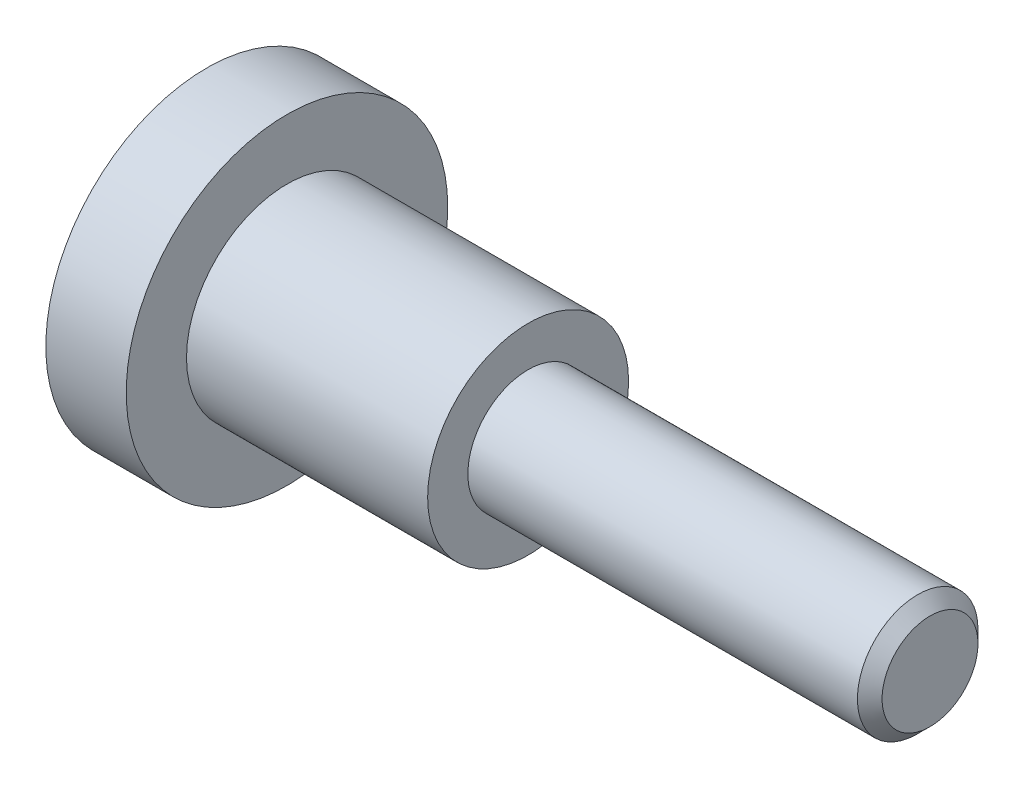
from build123d import *

# Parameters (mm, degrees)
SKETCH1_W           = 2
SKETCH1_H           = 4
SKETCH2_R           = 2.5
BOSS_EXTRUDE1_DEPTH = 6
SKETCH3_R           = 1.5
BOSS_EXTRUDE2_DEPTH = 10
CUT_EXTRUDE1_DEPTH  = 2
CHAMFER1_SIZE       = 0.3065


with BuildPart() as part:
    # Sketch1 → Revolve1 (revolve)
    with BuildSketch(Plane.XY):
        with Locations((-7, 2)):
            Rectangle(SKETCH1_W, SKETCH1_H)
    revolve(axis=Axis((-8, 0, 0), (1, 0, 0)))

    # Sketch2 → Boss-Extrude1 (add)
    with BuildSketch(Plane(origin=(-6, 0, 0), x_dir=(0, 0, -1), z_dir=(1, 0, 0))):
        Circle(SKETCH2_R)
    extrude(amount=BOSS_EXTRUDE1_DEPTH)

    # Sketch3 → Boss-Extrude2 (add)
    with BuildSketch(Plane(origin=(0, 0, 0), x_dir=(0, 0, -1), z_dir=(1, 0, 0))):
        Circle(SKETCH3_R)
    extrude(amount=BOSS_EXTRUDE2_DEPTH)

    # Sketch4 → Cut-Extrude1 (cut)
    with BuildSketch(Plane.ZY.offset(8)):
        Polygon((0, -1.154700538), (1, -0.577350269), (1, 0.577350269), (0, 1.154700538), (-1, 0.577350269), (-1, -0.577350269), align=None)
    extrude(amount=-CUT_EXTRUDE1_DEPTH, mode=Mode.SUBTRACT)

    # Sketch5 → Cut-Revolve1 (revolve, cut)
    with BuildSketch(Plane.XY):
        Polygon((-6, 1), (-6, 0), (-5.422649731, 0), align=None)
    revolve(axis=Axis((-6.000025, 0, 0), (1, 0, 0)), mode=Mode.SUBTRACT)

    # Chamfer1
    chamfer1_edges = [part.edges().sort_by_distance(p)[0] for p in [
        (10, 0, 1.5),
    ]]
    chamfer(chamfer1_edges, length=CHAMFER1_SIZE)


solid = part.part
